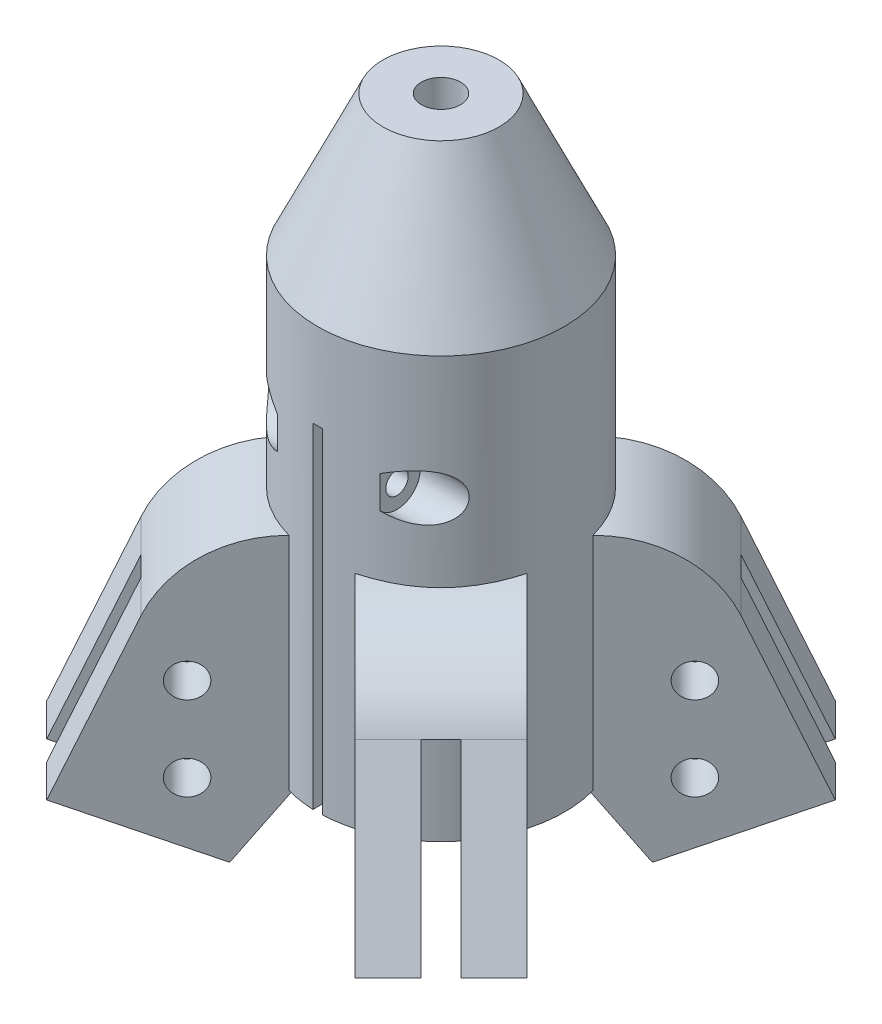
from build123d import *

# Parameters (mm, degrees)
SKETCH1_R                   = 13.21
SKETCH1_R_2                 = 2.1
BOSS_EXTRUDE1_DEPTH         = 20
CHAMFER1_SIZE               = 1.2
BOSS_EXTRUDE5_START         = 40
SKETCH7_R                   = 13.21
SKETCH7_R_2                 = 3.3
BOSS_EXTRUDE5_DEPTH         = 40
CUT_EXTRUDE3_START          = -0.5
SKETCH8_W                   = 13.21
SKETCH8_H                   = 35.8
CUT_EXTRUDE3_DEPTH          = 1
SKETCH11_W                  = 13.21
SKETCH11_H                  = 35.8
CUT_EXTRUDE5_DEPTH          = 2.5
CUT_EXTRUDE6_DEPTH          = 45.29975395
CUT_EXTRUDE6_DEPTH_BACK     = 45.29975395
SKETCH12_R                  = 1.2
SKETCH13_R                  = 2.5
CUT_EXTRUDE7_DEPTH          = 47.093038676
SKETCH15_R                  = 1.8
BOSS_EXTRUDE6_DEPTH         = 5
BOSS_EXTRUDE7_REACH         = 61.49
CIRPATTERN2_COUNT           = 4
CIRPATTERN2_COPY_1_SKETCH_R = 1.8
CIRPATTERN2_COPY_1_DEPTH    = 5
CIRPATTERN2_COPY_2_SKETCH_R = 1.8
CIRPATTERN2_COPY_2_DEPTH    = 5
CIRPATTERN2_COPY_3_SKETCH_R = 1.8
CIRPATTERN2_COPY_3_DEPTH    = 5
CHAMFER2_SIZE               = 6.994614872
CHAMFER2_SIZE2              = 15


with BuildPart() as part:
    # Sketch1 → Boss-Extrude1 (new body)
    with BuildSketch(Plane(origin=(0, 0, 0), x_dir=(1, 0, 0), z_dir=(0, 1, 0))):
        with Locations(Location((0, 0, 0), (0, 0, 270))):
            Circle(SKETCH1_R)
        with Locations(Location((0, 0, 0), (0, 0, 270))):
            Circle(SKETCH1_R_2, mode=Mode.SUBTRACT)
    extrude(amount=BOSS_EXTRUDE1_DEPTH)

    # Chamfer1
    chamfer1_edges = [part.edges().sort_by_distance(p)[0] for p in [
        (0, 0, -2.1),
    ]]
    chamfer(chamfer1_edges, length=CHAMFER1_SIZE)

    # Sketch7 → Boss-Extrude5 (add)
    with BuildSketch(Plane.XZ.offset(BOSS_EXTRUDE5_START)):
        with Locations(Location((0, 0, 0), (0, 0, 270))):
            Circle(SKETCH7_R)
        with Locations(Location((0, 0, 0), (0, 0, 270))):
            Circle(SKETCH7_R_2, mode=Mode.SUBTRACT)
    extrude(amount=-BOSS_EXTRUDE5_DEPTH)

    # Sketch8 → Cut-Extrude3 (cut)
    with BuildSketch(Plane(origin=(0, 0, 0), x_dir=(0, 0, -1), z_dir=(1, 0, 0)).offset(CUT_EXTRUDE3_START)):
        with Locations((-6.605, -22.1)):
            Rectangle(SKETCH8_W, SKETCH8_H)
    extrude(amount=CUT_EXTRUDE3_DEPTH, mode=Mode.SUBTRACT)

    # Sketch11 → Cut-Extrude5 (cut, symmetric)
    with BuildSketch(Plane(origin=(0, 0, 0), x_dir=(0, 0, -1), z_dir=(1, 0, 0))):
        with Locations((6.605, -22.1)):
            Rectangle(SKETCH11_W, SKETCH11_H)
    extrude(amount=CUT_EXTRUDE5_DEPTH, both=True, mode=Mode.SUBTRACT)

    # Sketch12 → Cut-Extrude6 (cut, two sides: drawn at the far end of the back side and taken through both)
    with BuildSketch(Plane.ZY.offset(-0.5).offset(-CUT_EXTRUDE6_DEPTH_BACK)):
        with Locations((10.21, -8.2)):
            Circle(SKETCH12_R)
    extrude(amount=CUT_EXTRUDE6_DEPTH + CUT_EXTRUDE6_DEPTH_BACK, mode=Mode.SUBTRACT)

    # Sketch13 → Cut-Extrude7 (cut, through all)
    with BuildSketch(Plane.ZY.offset(-5.5)):
        with Locations((10.21, -8.2)):
            Circle(SKETCH13_R)
    cut_extrude7 = extrude(amount=-CUT_EXTRUDE7_DEPTH, mode=Mode.SUBTRACT)

    # Mirror2: Cut-Extrude7 across plane
    add(cut_extrude7.mirror(Plane(origin=(0, 0, 0), x_dir=(0, 0, 1), z_dir=(1, 0, 0))), mode=Mode.SUBTRACT)

    # Sketch15 → Boss-Extrude6 (add)
    with BuildSketch(Plane(origin=(-1.060660172, 0, -1.060660172), x_dir=(-0.7071067811865488, -3.372135297382167e-15, 0.7071067811865462), z_dir=(-0.7071067811865462, 3.3721352973821793e-15, -0.7071067811865488))):
        Polygon((-22.70423895, -23.81017386), (-11.21, -23.81017386), (-11.21, -35.211035784), (-11.21, -40), (-15.990174244, -46.657077484), (-29.831605047, -40.876524454), align=None)
        with Locations((-19.21, -29.81017386)):
            Circle(SKETCH15_R, mode=Mode.SUBTRACT)
        with Locations((-19.21, -38.81017386)):
            Circle(SKETCH15_R, mode=Mode.SUBTRACT)
    boss_extrude6 = extrude(amount=BOSS_EXTRUDE6_DEPTH)

    # Mirror3: Boss-Extrude6 across plane
    add(boss_extrude6.mirror(Plane(origin=(0, 0, 0), x_dir=(-0.7071067811865488, 3.3721352973821916e-15, 0.7071067811865464), z_dir=(0.7071067811865462, -3.3721352973821793e-15, 0.7071067811865488))))

    # Boss-Extrude7: up to this face of the body (flat: up to its plane)
    boss_extrude7_end = Plane(part.part.faces().sort_by_distance((18.066702505, -34.728946199, -8.87431435))[0])
    # Sketch16 → Boss-Extrude7 (add, up to the picked face)
    with BuildSketch(Plane(origin=(-4.596194078, 0, -4.596194078), x_dir=(-0.7071067811865486, -3.1363800445660566e-15, 0.7071067811865465), z_dir=(-0.7071067811865465, 3.1363800445660664e-15, -0.7071067811865486)), mode=Mode.PRIVATE) as boss_extrude7_sk1:
        with BuildLine():
            Line((-11.500178259, -23.81017386), (-22.70423895, -23.81017386))
            ThreePointArc((-22.70423895, -23.81017386), (-18.231146382, -18.383887076), (-11.500178259, -16.347416226))
            Line((-11.500178259, -16.347416226), (-11.500178259, -23.81017386))
        make_face()
    boss_extrude7_tool1 = split(extrude(boss_extrude7_sk1.sketch, amount=-BOSS_EXTRUDE7_REACH, mode=Mode.PRIVATE), bisect_by=boss_extrude7_end, keep=Keep.BOTH, mode=Mode.PRIVATE)
    boss_extrude7 = boss_extrude7_tool1.solids().sort_by(Axis((6.682248, -20.729124, -15.874636), (0.7071067811865465, -3.1363800445660664e-15, 0.7071067811865486)))[0]
    add(boss_extrude7)

    # CirPattern2: Boss-Extrude6, Boss-Extrude7 ×4 about axis
    cirpattern2_axis = Axis((0, 0, 0), (0, 1, 0))
    add([boss_extrude6.rotate(cirpattern2_axis, i * 360 / CIRPATTERN2_COUNT) for i in range(1, CIRPATTERN2_COUNT)])
    add([boss_extrude7.rotate(cirpattern2_axis, i * 360 / CIRPATTERN2_COUNT) for i in range(1, CIRPATTERN2_COUNT)])

    # CirPattern2 copy 1 sketch → CirPattern2 copy 1 (add)
    with BuildSketch(Plane(origin=(1.060660172, 0, -1.060660172), x_dir=(0.7071067811865462, -3.372135297382167e-15, 0.7071067811865489), z_dir=(0.7071067811865488, -3.3721352973821793e-15, -0.7071067811865461))):
        Polygon((-22.70423895, 23.81017386), (-11.21, 23.81017386), (-11.21, 35.211035784), (-11.21, 40), (-15.990174244, 46.657077484), (-29.831605047, 40.876524454), align=None)
        with Locations((-19.21, 29.81017386)):
            Circle(CIRPATTERN2_COPY_1_SKETCH_R, mode=Mode.SUBTRACT)
        with Locations((-19.21, 38.81017386)):
            Circle(CIRPATTERN2_COPY_1_SKETCH_R, mode=Mode.SUBTRACT)
    extrude(amount=CIRPATTERN2_COPY_1_DEPTH)

    # CirPattern2 copy 2 sketch → CirPattern2 copy 2 (add)
    with BuildSketch(Plane(origin=(-1.060660172, 0, -1.060660172), x_dir=(0.7071067811865489, -3.372135297382167e-15, -0.7071067811865462), z_dir=(-0.7071067811865461, -3.3721352973821793e-15, -0.7071067811865488))):
        Polygon((-22.70423895, 23.81017386), (-11.21, 23.81017386), (-11.21, 35.211035784), (-11.21, 40), (-15.990174244, 46.657077484), (-29.831605047, 40.876524454), align=None)
        with Locations((-19.21, 29.81017386)):
            Circle(CIRPATTERN2_COPY_2_SKETCH_R, mode=Mode.SUBTRACT)
        with Locations((-19.21, 38.81017386)):
            Circle(CIRPATTERN2_COPY_2_SKETCH_R, mode=Mode.SUBTRACT)
    extrude(amount=CIRPATTERN2_COPY_2_DEPTH)

    # CirPattern2 copy 3 sketch → CirPattern2 copy 3 (add)
    with BuildSketch(Plane(origin=(-1.060660172, 0, 1.060660172), x_dir=(-0.7071067811865461, -3.372135297382167e-15, -0.707106781186549), z_dir=(-0.7071067811865489, -3.3721352973821793e-15, 0.707106781186546))):
        Polygon((-22.70423895, 23.81017386), (-11.21, 23.81017386), (-11.21, 35.211035784), (-11.21, 40), (-15.990174244, 46.657077484), (-29.831605047, 40.876524454), align=None)
        with Locations((-19.21, 29.81017386)):
            Circle(CIRPATTERN2_COPY_3_SKETCH_R, mode=Mode.SUBTRACT)
        with Locations((-19.21, 38.81017386)):
            Circle(CIRPATTERN2_COPY_3_SKETCH_R, mode=Mode.SUBTRACT)
    extrude(amount=CIRPATTERN2_COPY_3_DEPTH)

    # Chamfer2
    chamfer2_edges = [part.edges().sort_by_distance(p)[0] for p in [
        (0, 20, -13.21),
    ]]
    chamfer2_side = [part.faces().sort_by_distance(p)[0] for p in [
        (0, 20, -12.836364777),
    ]]
    chamfer(chamfer2_edges, length=CHAMFER2_SIZE, length2=CHAMFER2_SIZE2, reference=chamfer2_side[0])


solid = part.part
